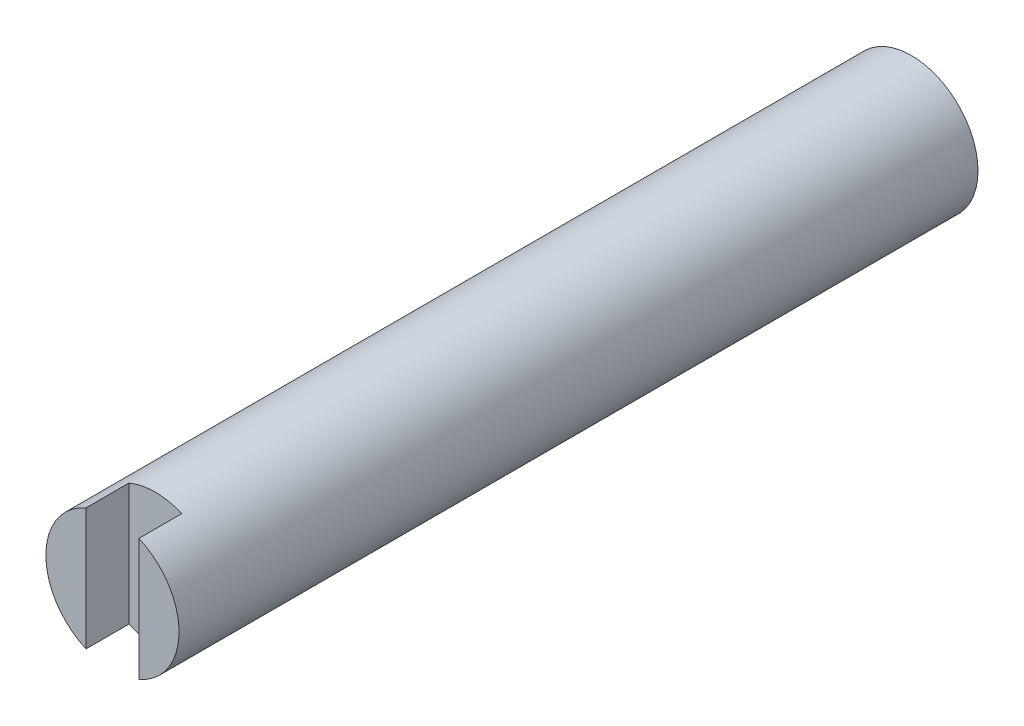
from build123d import *

# Parameters (mm, degrees)
EXTRUDE_START       = 10
SKETCH_1_R          = 12.5
EXTRUDE_1_DEPTH     = 150
SKETCH_2_W          = 9.934119033
SKETCH_2_H          = 36.471756902
CUT_EXTRUDE_1_DEPTH = 35


with BuildPart() as part:
    # Эскиз1 → Вытянуть1 (new body)
    with BuildSketch(Plane.XY.offset(EXTRUDE_START)):
        Circle(SKETCH_1_R)
    extrude(amount=EXTRUDE_1_DEPTH)

    # Эскиз2 → Вырез-Вытянуть1 (cut, symmetric)
    with BuildSketch(Plane(origin=(0, 0, 0), x_dir=(1, 0, 0), z_dir=(0, 1, 0))):
        with Locations((-0.001487871, -170.197950686)):
            Rectangle(SKETCH_2_W, SKETCH_2_H)
    extrude(amount=CUT_EXTRUDE_1_DEPTH, both=True, mode=Mode.SUBTRACT)


solid = part.part
